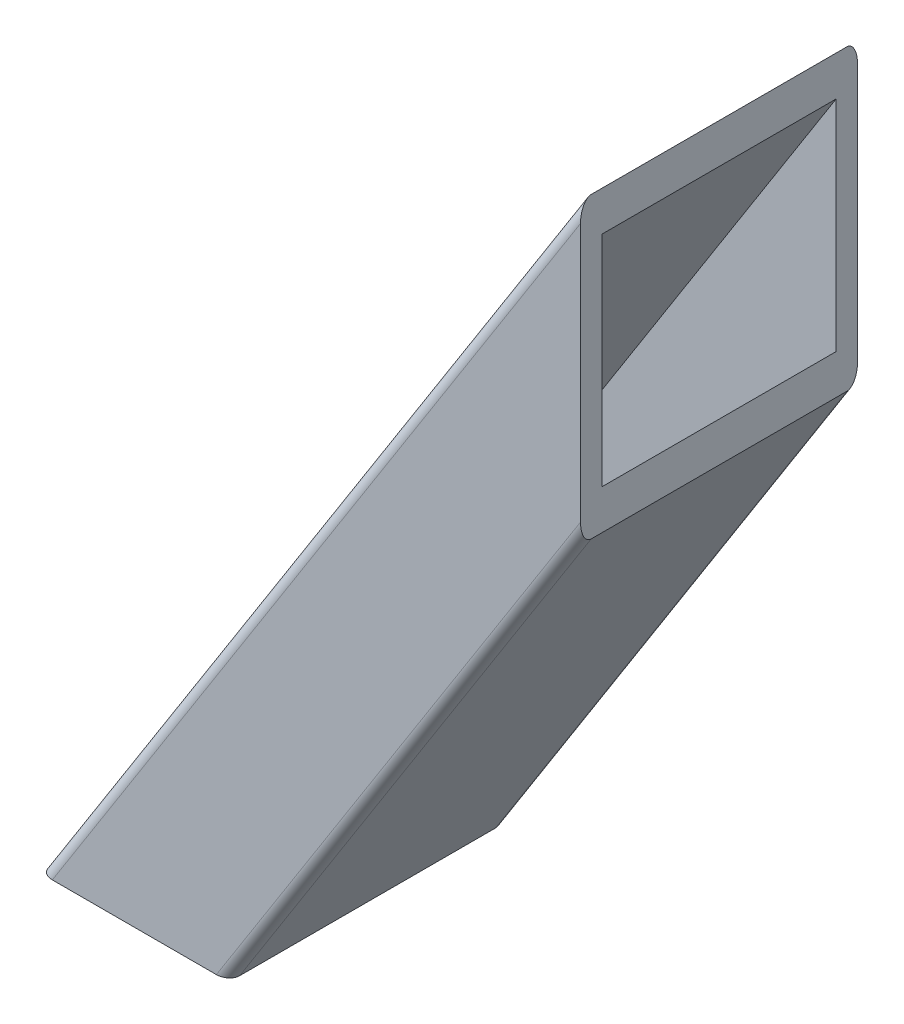
from build123d import *

# Parameters (mm, degrees)
BOSS_EXTRUDE1_DEPTH = 26
SHELL1_T            = -2
CUT_EXTRUDE1_REACH  = 90.591
SKETCH2_W           = 13.02701198
SKETCH2_H           = 22
FILLET1_R           = 1


with BuildPart() as part:
    # Sketch1 → Boss-Extrude1 (new body)
    with BuildSketch(Plane.XY):
        Polygon((0, 0), (-17.764107246, 0), (32.990484886, 80), (32.990484886, 52), align=None)
    extrude(amount=BOSS_EXTRUDE1_DEPTH)

    # Shell1
    shell1_openings = [part.faces().sort_by_distance(p)[0] for p in [
        (32.990484886, 66, 13),
    ]]
    offset(amount=SHELL1_T, openings=shell1_openings, kind=Kind.INTERSECTION)

    # Sketch2 → Cut-Extrude1 (cut, up to next)
    with BuildSketch(Plane(origin=(0, 2, 0), x_dir=(1, 0, 0), z_dir=(0, 1, 0)), mode=Mode.PRIVATE) as cut_extrude1_sk1:
        with Locations((-7.61318882, -13)):
            Rectangle(SKETCH2_W, SKETCH2_H)
    cut_extrude1_tool1 = extrude(cut_extrude1_sk1.sketch, amount=-CUT_EXTRUDE1_REACH, mode=Mode.PRIVATE) & part.part
    add(cut_extrude1_tool1.solids().sort_by_distance((-7.613189, 2, 13))[0], mode=Mode.SUBTRACT)

    # Fillet1
    fillet1_edges = [part.edges().sort_by_distance(p)[0] for p in [
        (7.61318882, 40, 26),
        (16.495242443, 26, 26),
        (7.61318882, 40, 0),
        (16.495242443, 26, 0),
    ]]
    fillet(fillet1_edges, radius=FILLET1_R)


solid = part.part
